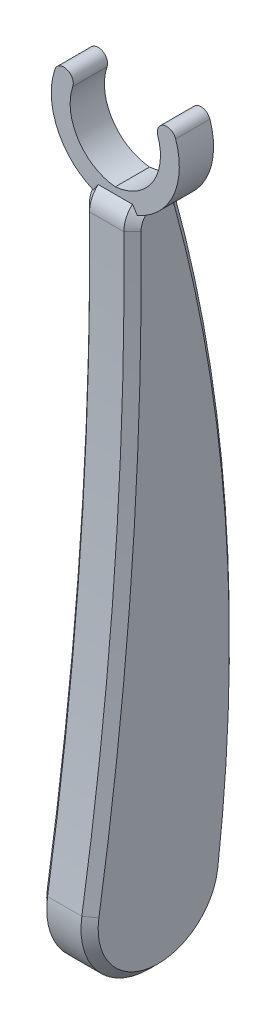
from build123d import *

# Parameters (mm, degrees)
BOSS_EXTRUDE1_DEPTH = 7.5
CHAMFER1_SIZE       = 2.5
SKETCH2_R           = 5
BOSS_EXTRUDE2_DEPTH = 10
BOSS_EXTRUDE3_DEPTH = 5


with BuildPart() as part:
    # Sketch1 → Boss-Extrude1 (new, symmetric)
    with BuildSketch(Plane.YZ):
        with BuildLine():
            ThreePointArc((-81.871756055, 19.753837344), (-104.803696773, 2.795280684), (-87.461525308, -19.847944306))
            ThreePointArc((-87.461525308, -19.847944306), (0.380210023, -22.09713345), (86.984359422, -7.232725467))
            ThreePointArc((86.984359422, -7.232725467), (92.427584063, 1.039709088), (84.922137279, 7.499595816))
            ThreePointArc((84.922137279, 7.499595816), (1.268561005, 10.133701432), (-81.871756055, 19.753837344))
        make_face()
    extrude(amount=BOSS_EXTRUDE1_DEPTH, both=True)

    # Chamfer1
    chamfer1_edges = [part.edges().sort_by_distance(p)[0] for p in [
        (-7.5, 0.380210023, -22.09713345),
        (-7.5, -104.803696773, 2.795280684),
        (-7.5, 1.268561005, 10.133701432),
        (7.5, 0.380210023, -22.09713345),
        (7.5, -104.803696773, 2.795280684),
        (7.5, 1.268561005, 10.133701432),
    ]]
    chamfer(chamfer1_edges, length=CHAMFER1_SIZE)

    # Sketch2 → Boss-Extrude2 (add)
    with BuildSketch(Plane(origin=(-7.5, 0, 0), x_dir=(0, -1, 0), z_dir=(-1, 0, 0))):
        with Locations(Location((85, 0, 0), (0, 0, 270))):
            Circle(SKETCH2_R)
    extrude(amount=BOSS_EXTRUDE2_DEPTH)

    # Sketch4 → Boss-Extrude3 (add, symmetric)
    with BuildSketch(Plane(origin=(0, 0, 0), x_dir=(0, 1, 0), z_dir=(0, 0, 1))):
        with BuildLine():
            ThreePointArc((86.984359422, 0), (95.845428844, -15.310516356), (113.386137378, -17.602678336))
            ThreePointArc((113.386137378, -17.602678336), (115.102678336, -14.113862622), (111.613862622, -12.397321664))
            ThreePointArc((111.613862622, -12.397321664), (99.049040037, -10.836148037), (92.5, 0))
            ThreePointArc((92.5, 0), (99.049040037, 10.836148037), (111.613862622, 12.397321664))
            ThreePointArc((111.613862622, 12.397321664), (115.102678336, 14.113862622), (113.386137378, 17.602678336))
            ThreePointArc((113.386137378, 17.602678336), (95.845428844, 15.310516356), (86.984359422, 0))
        make_face()
    extrude(amount=BOSS_EXTRUDE3_DEPTH, both=True)


solid = part.part
